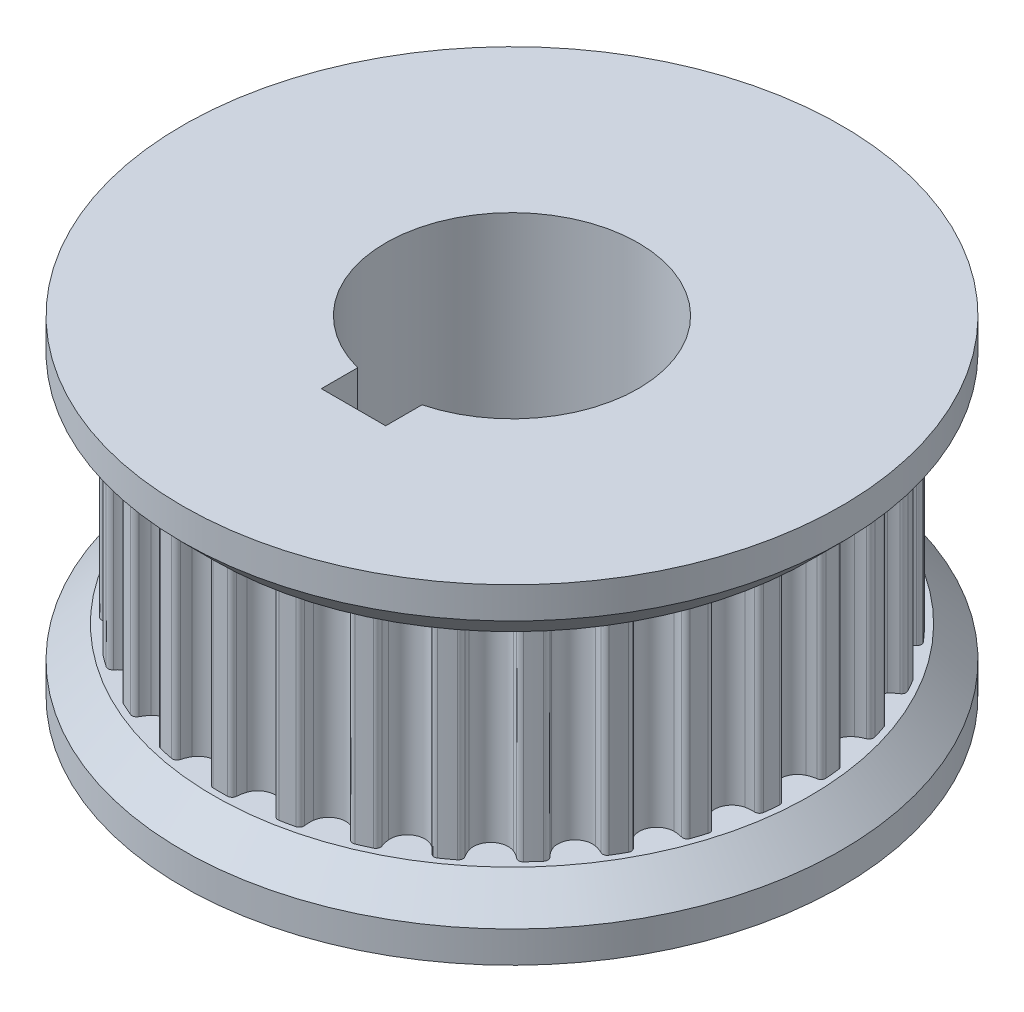
from build123d import *

# Parameters (mm, degrees)
SKETCH1_R           = 8.545296596
BOSS_EXTRUDE1_DEPTH = 3.25
BOSS_EXTRUDE2_DEPTH = 3.25
CIRPATTERN1_COUNT   = 30
SKETCH2_R           = 10.5
BOSS_EXTRUDE4_DEPTH = 2
BOSS_EXTRUDE5_START = 2
SKETCH3_R           = 10.5
BOSS_EXTRUDE5_DEPTH = 2
CHAMFER1_SIZE       = 1
CUT_EXTRUDE1_DEPTH  = 19.186533479


with BuildPart() as part:
    # Sketch1 → Boss-Extrude1 (new, symmetric)
    with BuildSketch(Plane(origin=(0, 0, 0), x_dir=(1, 0, 0), z_dir=(0, 1, 0))):
        Circle(SKETCH1_R)
    extrude(amount=BOSS_EXTRUDE1_DEPTH, both=True)

    # Sketch1<5> → Boss-Extrude2 (add, symmetric)
    with BuildSketch(Plane(origin=(0, 0, 0), x_dir=(1, 0, 0), z_dir=(0, 1, 0))):
        with BuildLine():
            ThreePointArc((0.425652094, 8.872168215), (0.604746925, 8.616891989), (0.893226721, 8.498484568))
            ThreePointArc((0.893226721, 8.498484568), (0, 8.545296596), (-0.893226721, 8.498484568))
            ThreePointArc((-0.893226721, 8.498484568), (-0.604746925, 8.616891989), (-0.425652094, 8.872168215))
            ThreePointArc((-0.425652094, 8.872168215), (-0.389834244, 9.008836206), (-0.373634583, 9.14918801))
            ThreePointArc((-0.373634583, 9.14918801), (-0.328795127, 9.249666016), (-0.227451596, 9.292513362))
            ThreePointArc((-0.227451596, 9.292513362), (0, 9.295296596), (0.227451596, 9.292513362))
            ThreePointArc((0.227451596, 9.292513362), (0.328795127, 9.249666016), (0.373634583, 9.14918801))
            ThreePointArc((0.373634583, 9.14918801), (0.389834244, 9.008836206), (0.425652094, 8.872168215))
        make_face()
    boss_extrude2 = extrude(amount=BOSS_EXTRUDE2_DEPTH, both=True)

    # CirPattern1: Boss-Extrude2 ×30 about axis
    cirpattern1_axis = Axis((0, -3.25, 0), (0, 1, 0))
    for i in range(1, CIRPATTERN1_COUNT):
        add(boss_extrude2.rotate(cirpattern1_axis, i * 360 / CIRPATTERN1_COUNT))

    # Sketch2 → Boss-Extrude4 (add)
    with BuildSketch(Plane(origin=(0, 3.25, 0), x_dir=(1, 0, 0), z_dir=(0, 1, 0))):
        Circle(SKETCH2_R)
    extrude(amount=BOSS_EXTRUDE4_DEPTH)

    # Sketch3 → Boss-Extrude5 (add)
    with BuildSketch(Plane.XZ.offset(3.25).offset(BOSS_EXTRUDE5_START)):
        Circle(SKETCH3_R)
    extrude(amount=-BOSS_EXTRUDE5_DEPTH)

    # Chamfer1
    chamfer1_edges = [part.edges().sort_by_distance(p)[0] for p in [
        (-10.5, -3.25, 0),
        (-10.5, 3.25, 0),
    ]]
    chamfer(chamfer1_edges, length=CHAMFER1_SIZE)

    # Sketch4 → Cut-Extrude1 (cut, through all)
    with BuildSketch(Plane.XZ.offset(5.25)):
        with BuildLine():
            Line((1.025, 5.05), (-1.025, 5.05))
            Line((-1.025, 5.05), (-1.025, 3.892300091))
            ThreePointArc((-1.025, 3.892300091), (0, -4.025), (1.025, 3.892300091))
            Line((1.025, 3.892300091), (1.025, 5.05))
        make_face()
    extrude(amount=-CUT_EXTRUDE1_DEPTH, mode=Mode.SUBTRACT)


solid = part.part
